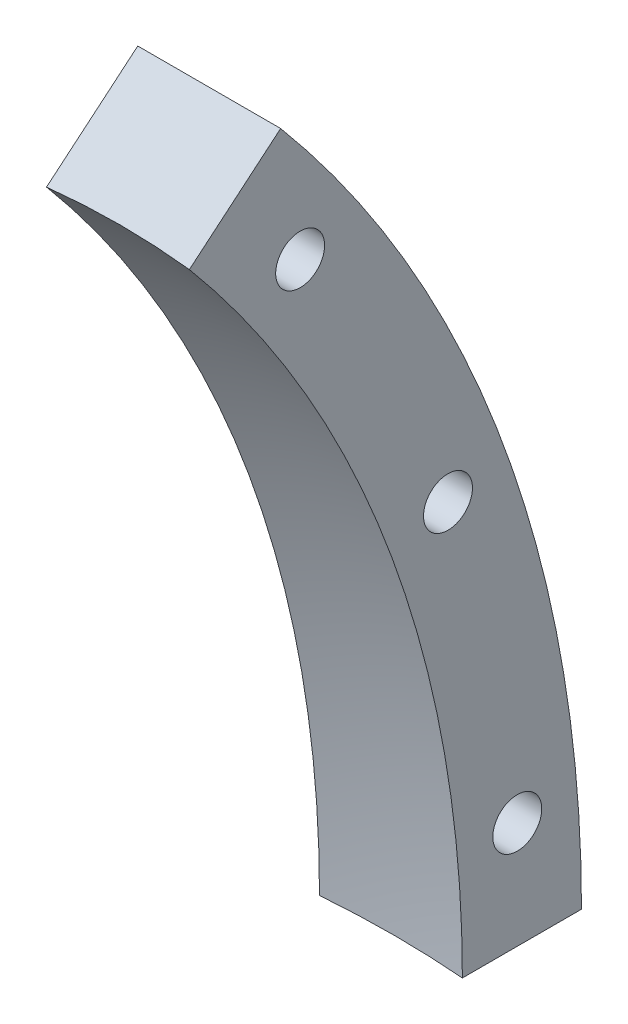
from build123d import *

# Parameters (mm, degrees)
REVOLVE1_ANGLE     = 40
SKETCH3_R          = 3.2639
CUT_EXTRUDE1_DEPTH = 205.703085759


with BuildPart() as part:
    # Sketch1 → Revolve1 (revolve)
    with BuildSketch(Plane(origin=(0, 0, 0), x_dir=(1, 0, 0), z_dir=(0, 1, 0))):
        Polygon((0, 152.4), (-9.525, 152.4), (-9.525, 171.45), (9.525, 171.45), (9.525, 152.4), align=None)
    revolve(axis=Axis((0, 0, 0), (1, 0, 0)), revolution_arc=REVOLVE1_ANGLE)

    # Sketch2 → Cut-Revolve1 (revolve, cut)
    with BuildSketch(Plane(origin=(0, 0, 0), x_dir=(1, 0, 0), z_dir=(0, 1, 0))):
        with BuildLine():
            Line((-117.856, 38.1), (117.856, 38.1))
            ThreePointArc((117.856, 38.1), (0, 155.956), (-117.856, 38.1))
        make_face()
    revolve(axis=Axis((0, 0, 0), (1, 0, 0)), mode=Mode.SUBTRACT)

    # Sketch3 → Cut-Extrude1 (cut, through all)
    with BuildSketch(Plane(origin=(9.525, 0, 0), x_dir=(0, 0, -1), z_dir=(1, 0, 0))):
        with Locations((162.888028743, 14.250855939)):
            Circle(SKETCH3_R)
        with Locations((153.64936083, 55.923793856)):
            Circle(SKETCH3_R)
        with Locations((133.939742895, 93.785617641)):
            Circle(SKETCH3_R)
    extrude(amount=-CUT_EXTRUDE1_DEPTH, mode=Mode.SUBTRACT)


solid = part.part
